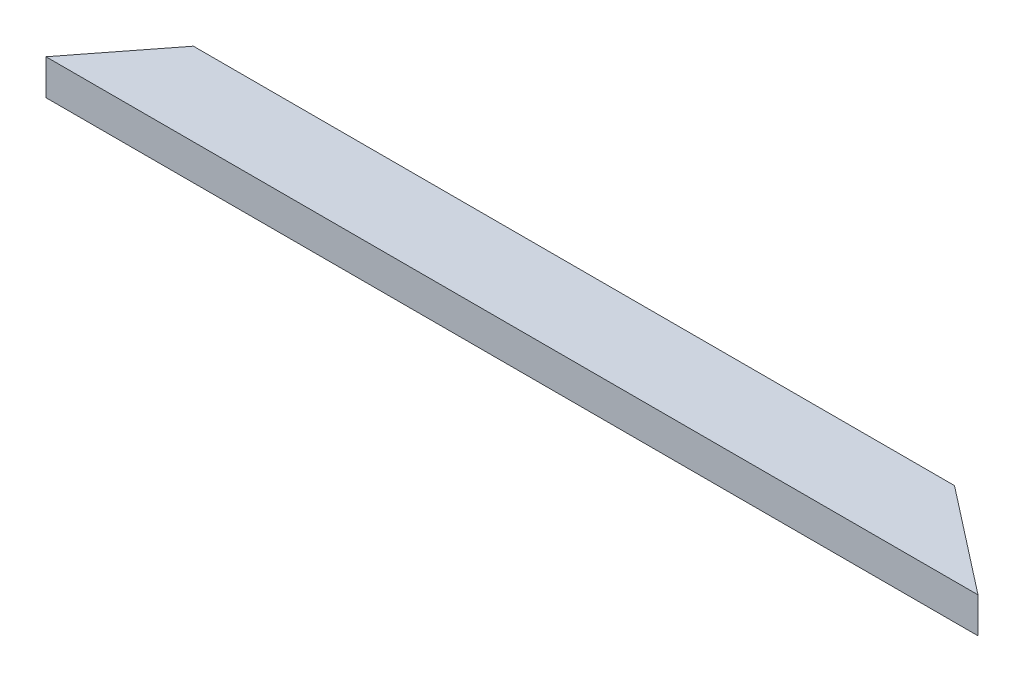
from build123d import *

# Parameters (mm, degrees)
BOSS_EXTRUDE1_DEPTH = 38.1


with BuildPart() as part:
    # Sketch1 → Boss-Extrude1 (new body)
    with BuildSketch(Plane(origin=(0, 0, 0), x_dir=(1, 0, 0), z_dir=(0, 1, 0))):
        Polygon((0, 0), (1000, 0), (885.873481675, 88.9), (69.249549675, 88.9), align=None)
    extrude(amount=BOSS_EXTRUDE1_DEPTH)


solid = part.part
